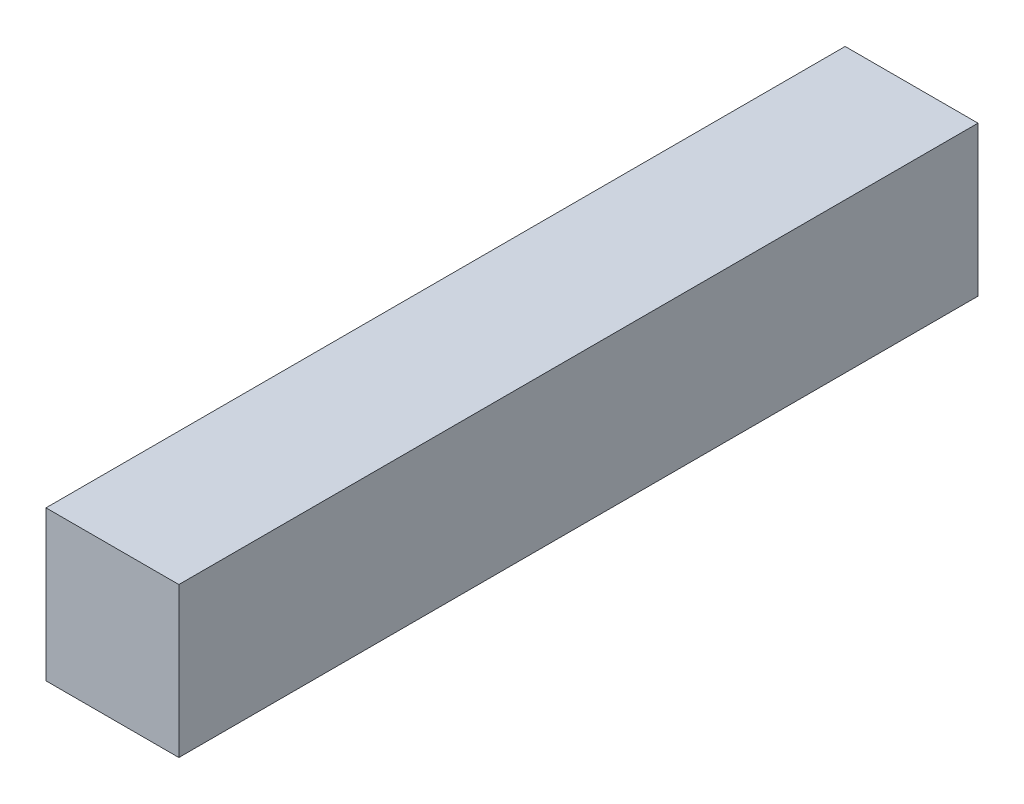
from build123d import *

# Parameters (mm, degrees)
SKETCH1_W           = 13.3
SKETCH1_H           = 15
BOSS_EXTRUDE1_DEPTH = 80


with BuildPart() as part:
    # Sketch1 → Boss-Extrude1 (new body)
    with BuildSketch(Plane.XY):
        with Locations((6.65, 7.5)):
            Rectangle(SKETCH1_W, SKETCH1_H)
    extrude(amount=BOSS_EXTRUDE1_DEPTH)


solid = part.part
